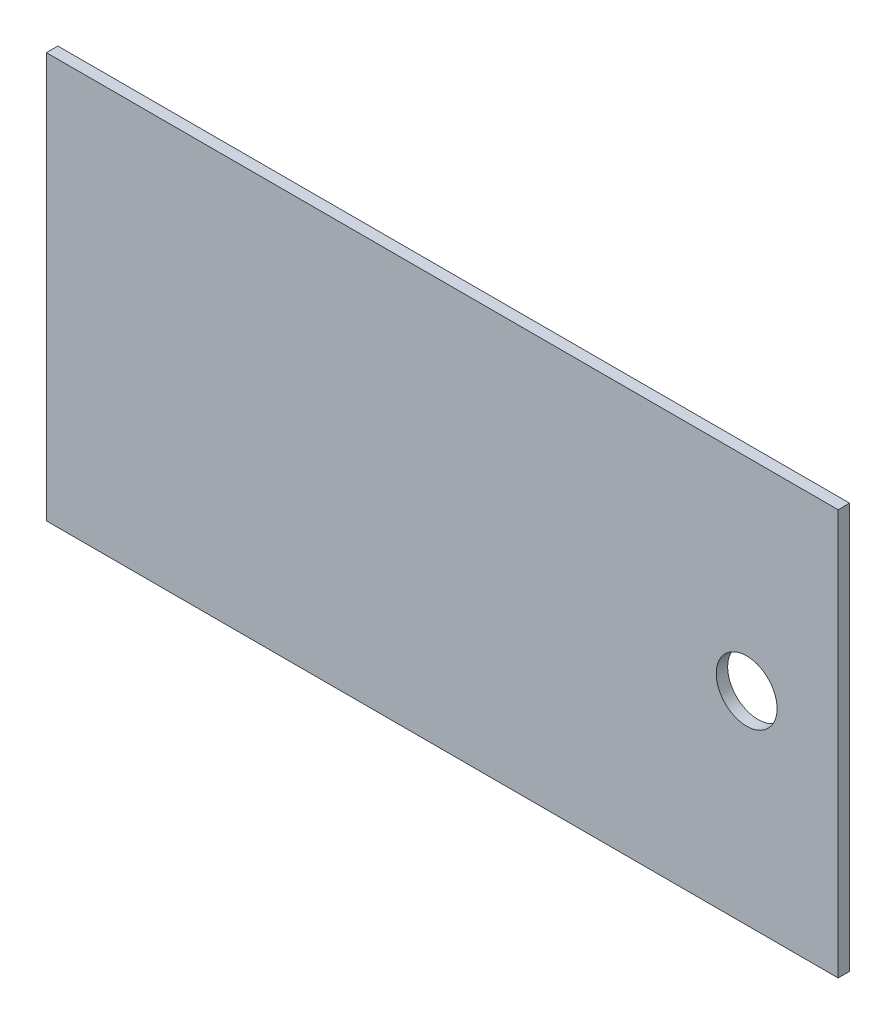
from build123d import *

# Parameters (mm, degrees)
SKETCH3_W           = 173
SKETCH3_H           = 88.6
BOSS_EXTRUDE1_DEPTH = 2.5
SKETCH4_R           = 6.65
CUT_EXTRUDE1_DEPTH  = 10


with BuildPart() as part:
    # Sketch3 → Boss-Extrude1 (new body)
    with BuildSketch(Plane.XY):
        with Locations((-74.897494343, -18.062521629)):
            Rectangle(SKETCH3_W, SKETCH3_H)
    extrude(amount=BOSS_EXTRUDE1_DEPTH)

    # Sketch4 → Cut-Extrude1 (cut)
    with BuildSketch(Plane.XY.offset(2.5)):
        with Locations((-8.397494343, -18.062521629)):
            Circle(SKETCH4_R)
    extrude(amount=-CUT_EXTRUDE1_DEPTH, mode=Mode.SUBTRACT)


solid = part.part
